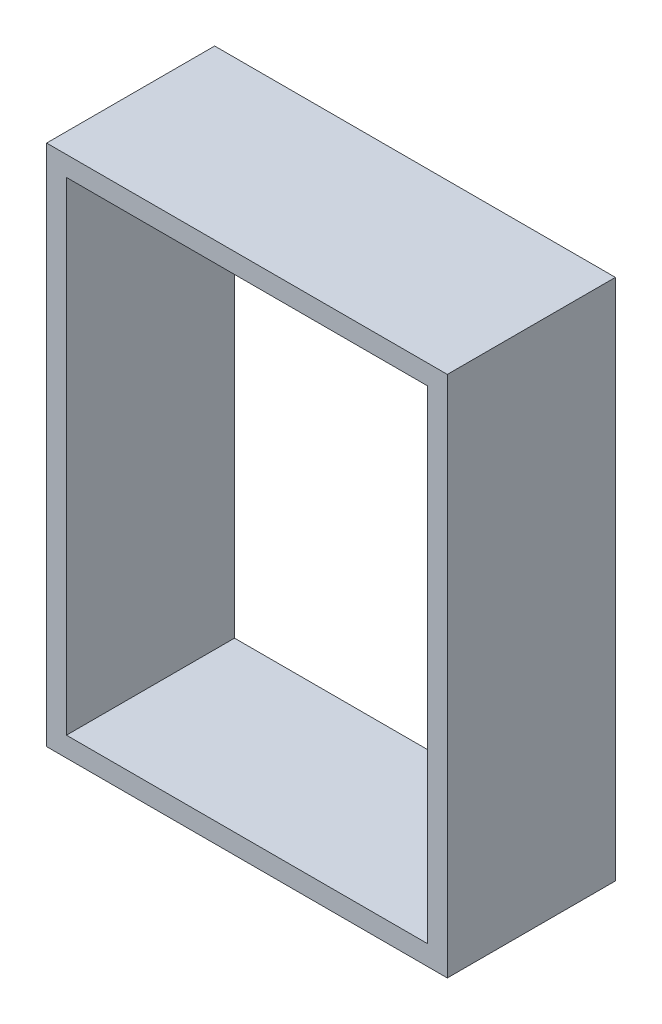
from build123d import *

# Parameters (mm, degrees)
STRAP_SKETCH_W   = 30.28
STRAP_SKETCH_H   = 39.5
STRAP_SKETCH_W_2 = 27.28
STRAP_SKETCH_H_2 = 36.5
STRAP_DEPTH      = 6.35


with BuildPart() as part:
    # Strap Sketch → Strap (new, symmetric)
    with BuildSketch(Plane.XY):
        with Locations((-10.41, 25)):
            Rectangle(STRAP_SKETCH_W, STRAP_SKETCH_H)
        with Locations((-10.41, 25)):
            Rectangle(STRAP_SKETCH_W_2, STRAP_SKETCH_H_2, mode=Mode.SUBTRACT)
    extrude(amount=STRAP_DEPTH, both=True)


solid = part.part
